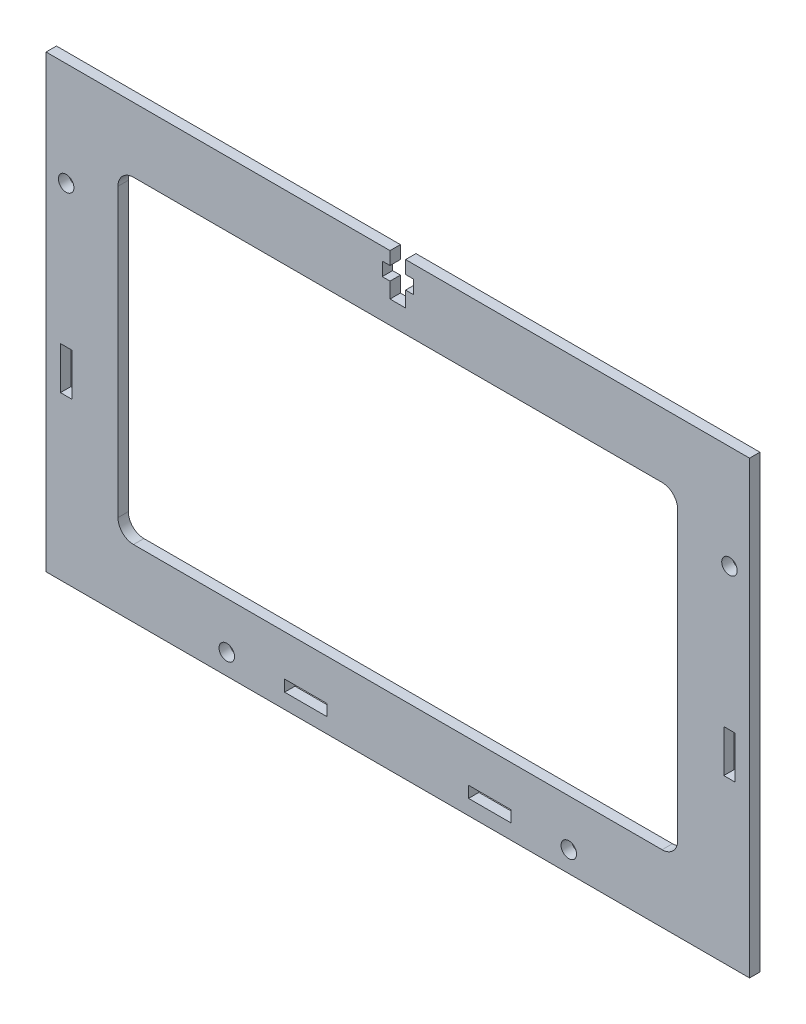
from build123d import *

# Parameters (mm, degrees)
SKETCH_1_R      = 1.5
SKETCH_1_W      = 8.2
SKETCH_1_H      = 2.2
SKETCH_1_W_2    = 2.2
SKETCH_1_H_2    = 8.2
EXTRUDE_1_DEPTH = 2


with BuildPart() as part:
    # 草图1 → 凸台-拉伸1 (new body)
    with BuildSketch(Plane.XY):
        Polygon((-68.061769393, -13.095981945), (-52.184883937, -13.095981945), (-18.934883937, -13.095981945), (18.565116063, -13.095981945), (67.695116063, -13.095981945), (67.695116063, 73.779018055), (1.315116063, 73.779018055), (1.315116063, 71.279018055), (2.815116063, 71.279018055), (2.815116063, 68.679018055), (1.315116063, 68.679018055), (1.315116063, 65.679018055), (-1.684883937, 65.679018055), (-1.684883937, 68.679018055), (-3.184883937, 68.679018055), (-3.184883937, 71.279018055), (-1.684883937, 71.279018055), (-1.684883937, 73.779018055), (-68.061769393, 73.779018055), align=None)
        with Locations((-33.184883937, -9.095981945)):
            Circle(SKETCH_1_R, mode=Mode.SUBTRACT)
        with Locations((-17.934883937, -9.095981946)):
            Rectangle(SKETCH_1_W, SKETCH_1_H, mode=Mode.SUBTRACT)
        with Locations((-64.184883937, 22.341518055)):
            Rectangle(SKETCH_1_W_2, SKETCH_1_H_2, mode=Mode.SUBTRACT)
        with Locations((17.565116063, -9.095981946)):
            Rectangle(SKETCH_1_W, SKETCH_1_H, mode=Mode.SUBTRACT)
        with Locations((32.815116063, -9.095981945)):
            Circle(SKETCH_1_R, mode=Mode.SUBTRACT)
        with Locations((63.815116063, 22.341518055)):
            Rectangle(SKETCH_1_W_2, SKETCH_1_H_2, mode=Mode.SUBTRACT)
        with BuildLine():
            ThreePointArc((50.815116063, 61.279018055), (52.936436406, 60.400338398), (53.815116063, 58.279018055))
            Line((53.815116063, 58.279018055), (53.815116063, 2.904018055))
            ThreePointArc((53.815116063, 2.904018055), (52.936436406, 0.782697711), (50.815116063, -0.095981945))
            Line((50.815116063, -0.095981945), (-51.184883937, -0.095981945))
            ThreePointArc((-51.184883937, -0.095981945), (-53.306204281, 0.782697711), (-54.184883937, 2.904018055))
            Line((-54.184883937, 2.904018055), (-54.184883937, 58.279018055))
            ThreePointArc((-54.184883937, 58.279018055), (-53.306204281, 60.400338398), (-51.184883937, 61.279018055))
            Line((-51.184883937, 61.279018055), (50.815116063, 61.279018055))
        make_face(mode=Mode.SUBTRACT)
        with Locations((-64.184883937, 53.779018055)):
            Circle(SKETCH_1_R, mode=Mode.SUBTRACT)
        with Locations((63.815116063, 53.779018055)):
            Circle(SKETCH_1_R, mode=Mode.SUBTRACT)
    extrude(amount=EXTRUDE_1_DEPTH)


solid = part.part
